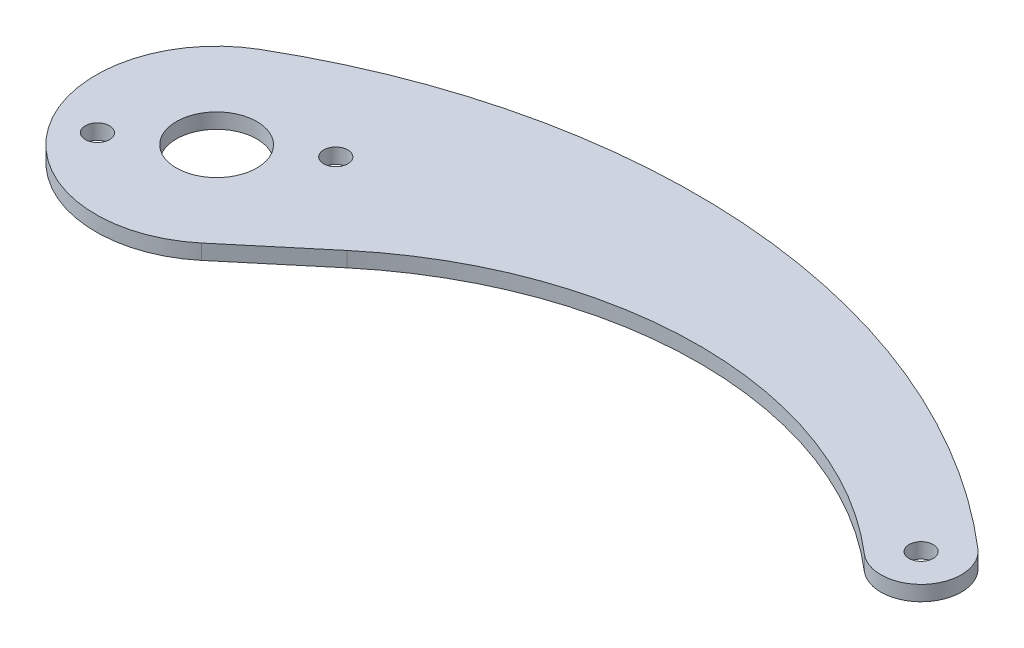
from build123d import *

# Parameters (mm, degrees)
ESQUISSE1_R             = 4
ESQUISSE1_R_2           = 1.2
BOSS_EXTRU_1_DEPTH      = 1.5
ESQUISSE2_R             = 1.2
ENL_V_MAT_EXTRU_1_DEPTH = 77.560702478


with BuildPart() as part:
    # Esquisse1 → Boss.-Extru.1 (new body)
    with BuildSketch(Plane(origin=(0, 0, 0), x_dir=(1, 0, 0), z_dir=(0, 1, 0))):
        with BuildLine():
            Line((7.702709274, -9.201536276), (15.560016707, -2.624096052))
            ThreePointArc((15.560016707, -2.624096052), (41.546598932, 6.702908226), (67.385064935, -3.026898513))
            ThreePointArc((67.385064935, -3.026898513), (73.026898513, -2.614935065), (72.614935065, 3.026898513))
            ThreePointArc((72.614935065, 3.026898513), (34.4702408, 19.282589401), (-6.02615989, 10.377157462))
            ThreePointArc((-6.02615989, 10.377157462), (-9.825172598, -6.889556112), (7.702709274, -9.201536276))
        make_face()
        with Locations(Location((0, 0, 0), (0, 0, 270))):
            Circle(ESQUISSE1_R, mode=Mode.SUBTRACT)
        with Locations(Location((70, 0, 0), (0, 0, 270))):
            Circle(ESQUISSE1_R_2, mode=Mode.SUBTRACT)
    extrude(amount=BOSS_EXTRU_1_DEPTH)

    # Esquisse2 → Enlèv. mat.-Extru.1 (cut, through all)
    with BuildSketch(Plane(origin=(0, 1.5, 0), x_dir=(1, 0, 0), z_dir=(0, 1, 0))):
        with Locations(Location((-6.959497257, -4.880102246, 0), (0, 0, 270))):
            Circle(ESQUISSE2_R)
        with Locations(Location((6.959497257, 4.880102246, 0), (0, 0, 270))):
            Circle(ESQUISSE2_R)
    extrude(amount=-ENL_V_MAT_EXTRU_1_DEPTH, mode=Mode.SUBTRACT)


solid = part.part
